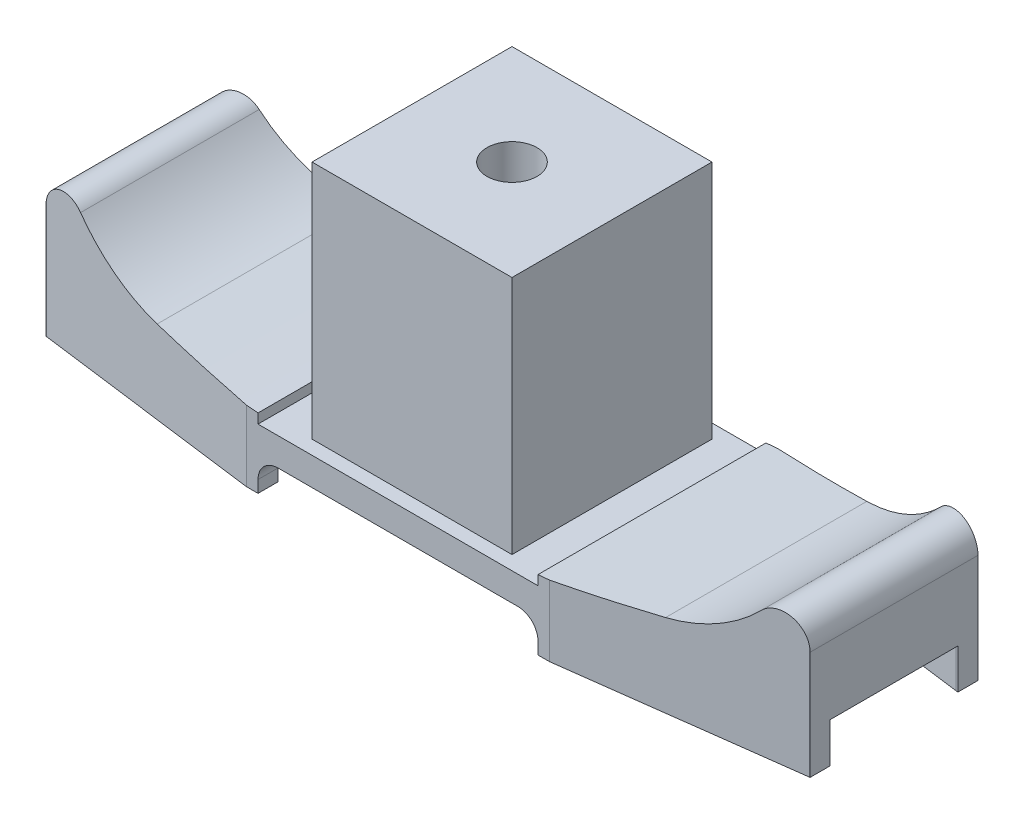
from build123d import *

# Parameters (mm, degrees)
BOSS_EXTRUDE1_DEPTH     = 2
BOSS_EXTRUDE2_DEPTH     = 1
BOSS_EXTRUDE3_DEPTH     = 12
BOSS_EXTRUDE4_REACH     = 31.886
CUT_EXTRUDE1_DEPTH      = 27.734434724
CUT_EXTRUDE1_DEPTH_BACK = 27.734434724
SKETCH6_R               = 1.25
CUT_EXTRUDE2_DEPTH      = 25.948268421
CUT_EXTRUDE3_DEPTH      = 27.830693137


with BuildPart() as part:
    # Sketch1 → Boss-Extrude1 (new body)
    with BuildSketch(Plane(origin=(0, 0, 0), x_dir=(1, 0, 0), z_dir=(0, 1, 0))):
        with BuildLine():
            Line((-7.576663768, 5.7), (-19.534464968, 4.165854918))
            ThreePointArc((-19.534464968, 4.165854918), (-23.193935143, -0.225628046), (-19.084438942, -4.199151112))
            Line((-19.084438942, -4.199151112), (-7.577930804, -5.7))
            Line((-7.577930804, -5.7), (7.577930804, -5.7))
            Line((7.577930804, -5.7), (19.084438942, -4.199151112))
            ThreePointArc((19.084438942, -4.199151112), (23.2, 0), (19.084438942, 4.199151112))
            Line((19.084438942, 4.199151112), (7.577930804, 5.7))
            Line((7.577930804, 5.7), (-7.576663768, 5.7))
        make_face()
        with BuildLine():
            Line((-7.512988467, -4.7), (-19.013197102, -3.199972787))
            ThreePointArc((-19.013197102, -3.199972787), (-22.193903464, -0.197435212), (-19.407211404, 3.173984699))
            Line((-19.407211404, 3.173984699), (-7.512777295, 4.7))
            Line((-7.512777295, 4.7), (7.512988467, 4.7))
            Line((7.512988467, 4.7), (19.013197102, 3.199972787))
            ThreePointArc((19.013197102, 3.199972787), (22.2, 0), (19.013197102, -3.199972787))
            Line((19.013197102, -3.199972787), (7.512988467, -4.7))
            Line((7.512988467, -4.7), (-7.512988467, -4.7))
        make_face(mode=Mode.SUBTRACT)
    extrude(amount=BOSS_EXTRUDE1_DEPTH)

    # Sketch2 → Boss-Extrude2 (add)
    with BuildSketch(Plane(origin=(0, 2, 0), x_dir=(1, 0, 0), z_dir=(0, 1, 0))):
        with BuildLine():
            Line((7.577930804, -5.7), (19.084438942, -4.199151112))
            ThreePointArc((19.084438942, -4.199151112), (23.2, 0), (19.084438942, 4.199151112))
            Line((19.084438942, 4.199151112), (7.577930804, 5.7))
            Line((7.577930804, 5.7), (-7.576663768, 5.7))
            Line((-7.576663768, 5.7), (-19.534464968, 4.165854918))
            ThreePointArc((-19.534464968, 4.165854918), (-23.193935143, -0.225628046), (-19.084438942, -4.199151112))
            Line((-19.084438942, -4.199151112), (-7.577930804, -5.7))
            Line((-7.577930804, -5.7), (7.577930804, -5.7))
        make_face()
    extrude(amount=BOSS_EXTRUDE2_DEPTH)

    # Sketch3 → Boss-Extrude3 (add)
    with BuildSketch(Plane(origin=(0, 3, 0), x_dir=(1, 0, 0), z_dir=(0, 1, 0))):
        Polygon((-5, 0), (-5, 5), (5, 5), (5, -5), (-5, -5), align=None)
    extrude(amount=BOSS_EXTRUDE3_DEPTH)

    # Boss-Extrude4: up to this face of the body (flat: up to its plane)
    boss_extrude4_end = Plane(part.part.faces().sort_by_distance((0.000633518, 1.5, -5.7))[0])
    # Sketch4 → Boss-Extrude4 (add, up to the picked face)
    with BuildSketch(Plane.XY.offset(5.7), mode=Mode.PRIVATE) as boss_extrude4_sk1:
        with BuildLine():
            Line((-19.103038774, 3), (-7, 3))
            Line((-7, 3), (-7, 3.485357144))
            ThreePointArc((-7, 3.485357144), (-9.86131573, 3.767251876), (-12.711609357, 4.144635751))
            ThreePointArc((-12.711609357, 4.144635751), (-15.114103805, 4.934855361), (-17.117340124, 6.478704724))
            ThreePointArc((-17.117340124, 6.478704724), (-18.375058248, 6.768970937), (-19.103038774, 5.703065825))
            Line((-19.103038774, 5.703065825), (-19.103038774, 3))
        make_face()
    boss_extrude4_tool1 = split(extrude(boss_extrude4_sk1.sketch, amount=-BOSS_EXTRUDE4_REACH, mode=Mode.PRIVATE), bisect_by=boss_extrude4_end, keep=Keep.BOTH, mode=Mode.PRIVATE)
    # Sketch4 → Boss-Extrude4 (add, up to the picked face)
    with BuildSketch(Plane.XY.offset(5.7), mode=Mode.PRIVATE) as boss_extrude4_sk2:
        with BuildLine():
            Line((7, 3.485357144), (7, 3))
            Line((7, 3), (19.103038774, 3))
            Line((19.103038774, 3), (19.103038774, 5.420959691))
            ThreePointArc((19.103038774, 5.420959691), (18.322193887, 6.584407955), (16.949634957, 6.302605569))
            ThreePointArc((16.949634957, 6.302605569), (15.0061995, 4.878805237), (12.711609357, 4.144635751))
            ThreePointArc((12.711609357, 4.144635751), (9.86131573, 3.767251876), (7, 3.485357144))
        make_face()
    boss_extrude4_tool2 = split(extrude(boss_extrude4_sk2.sketch, amount=-BOSS_EXTRUDE4_REACH, mode=Mode.PRIVATE), bisect_by=boss_extrude4_end, keep=Keep.BOTH, mode=Mode.PRIVATE)
    add(boss_extrude4_tool1.solids().sort_by(Axis((-15.203187, 4.213829, 5.7), (0, 0, -1)))[0])
    add(boss_extrude4_tool2.solids().sort_by(Axis((15.148816, 4.17304, 5.7), (0, 0, -1)))[0])

    # Sketch5 → Cut-Extrude1 (cut, two sides: drawn at the far end of the back side and taken through both)
    with BuildSketch(Plane.XZ.offset(-3).offset(-CUT_EXTRUDE1_DEPTH_BACK)):
        with BuildLine():
            ThreePointArc((19.103038774, -4.198735883), (23.2, 0), (19.103038774, 4.198735883))
            Line((19.103038774, 4.198735883), (19.103038774, -4.198735883))
        make_face()
        with BuildLine():
            ThreePointArc((19.084438942, 4.199151112), (19.093739088, 4.198953796), (19.103038774, 4.198735883))
            Line((19.103038774, 4.198735883), (19.103038774, 5.7))
            Line((19.103038774, 5.7), (7.577930804, 5.7))
            Line((7.577930804, 5.7), (19.084438942, 4.199151112))
        make_face()
        with BuildLine():
            Line((19.103038774, -5.7), (19.103038774, -4.198735883))
            ThreePointArc((19.103038774, -4.198735883), (19.093739088, -4.198953796), (19.084438942, -4.199151112))
            Line((19.084438942, -4.199151112), (7.577930804, -5.7))
            Line((7.577930804, -5.7), (19.103038774, -5.7))
        make_face()
        with BuildLine():
            Line((-19.534464968, -4.165854918), (-19.103038774, -4.221205426))
            Line((-19.103038774, -4.221205426), (-19.103038774, 4.198735883))
            ThreePointArc((-19.103038774, 4.198735883), (-23.194424582, 0.216338692), (-19.534464968, -4.165854918))
        make_face()
        Polygon((-7.576663768, -5.7), (-19.103038774, -4.221205426), (-19.103038774, -5.7), align=None)
        with BuildLine():
            Line((-19.103038774, 5.7), (-19.103038774, 4.198735883))
            ThreePointArc((-19.103038774, 4.198735883), (-19.093739088, 4.198953796), (-19.084438942, 4.199151112))
            Line((-19.084438942, 4.199151112), (-7.577930804, 5.7))
            Line((-7.577930804, 5.7), (-19.103038774, 5.7))
        make_face()
    extrude(amount=CUT_EXTRUDE1_DEPTH + CUT_EXTRUDE1_DEPTH_BACK, mode=Mode.SUBTRACT)

    # Sketch6 → Cut-Extrude2 (cut, through all)
    with BuildSketch(Plane(origin=(0, 15, 0), x_dir=(1, 0, 0), z_dir=(0, 1, 0))):
        with Locations(Location((0, 0, 0), (0, 0, 270))):
            Circle(SKETCH6_R)
    extrude(amount=-CUT_EXTRUDE2_DEPTH, mode=Mode.SUBTRACT)

    # Sketch7 → Cut-Extrude3 (cut, through all)
    with BuildSketch(Plane(origin=(0, 0, -5.7), x_dir=(-1, 0, 0), z_dir=(0, 0, -1))):
        with BuildLine():
            Line((-7, 0.6), (-7, 0))
            Line((-7, 0), (7, 0))
            Line((7, 0), (7, 0.6))
            ThreePointArc((7, 0.6), (6.707106781, 1.307106781), (6, 1.6))
            Line((6, 1.6), (-6, 1.6))
            ThreePointArc((-6, 1.6), (-6.707106781, 1.307106781), (-7, 0.6))
        make_face()
    extrude(amount=-CUT_EXTRUDE3_DEPTH, mode=Mode.SUBTRACT)


solid = part.part
